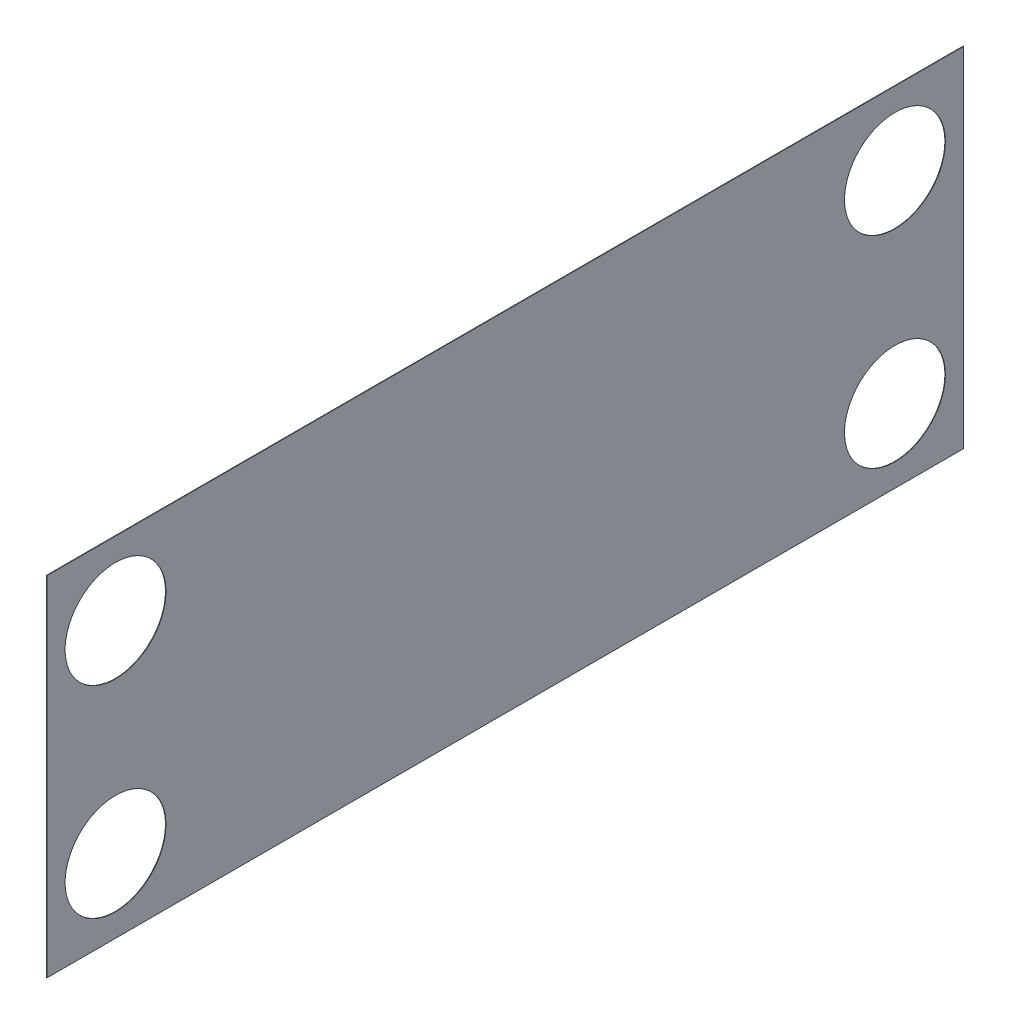
from build123d import *

# Parameters (mm, degrees)
SKETCH1_W             = 100
SKETCH1_H             = 38
BOSS_EXTRUDE1_DEPTH   = 0.0508
M10_CLEARANCE_HOLE1_D = 11


with BuildPart() as part:
    # Sketch1 → Boss-Extrude1 (new body)
    with BuildSketch(Plane(origin=(0, 0, 0), x_dir=(0, 0, -1), z_dir=(1, 0, 0))):
        Rectangle(SKETCH1_W, SKETCH1_H)
    extrude(amount=BOSS_EXTRUDE1_DEPTH)

    # M10 Clearance Hole1 (through all)
    with Locations(Plane(origin=(0.0508, 0, 0), x_dir=(0, 0, -1), z_dir=(1, 0, 0))):
        with Locations((-42.5, 11), (-42.5, -11), (42.5, 11), (42.5, -11)):
            Hole(M10_CLEARANCE_HOLE1_D / 2)


solid = part.part
